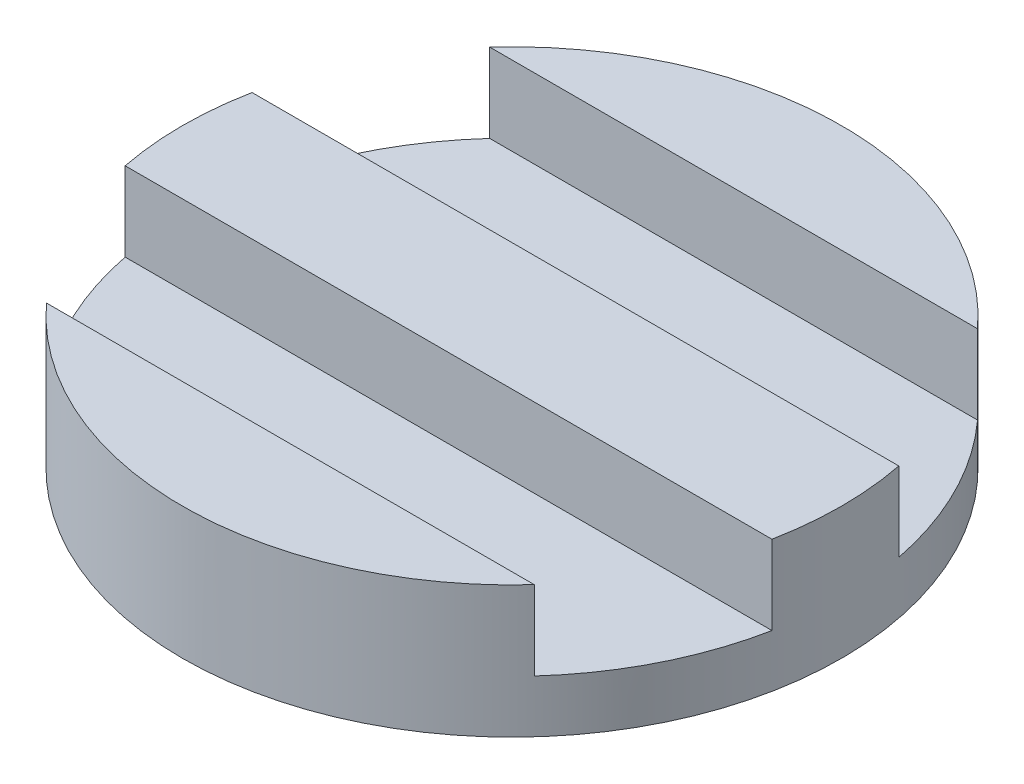
from build123d import *

# Parameters (mm, degrees)
SKETCH2_R           = 125
BOSS_EXTRUDE1_DEPTH = 50
CUT_EXTRUDE1_START  = -30
CUT_EXTRUDE1_DEPTH  = 30


with BuildPart() as part:
    # Sketch2 → Boss-Extrude1 (new body)
    with BuildSketch(Plane(origin=(0, 0, 0), x_dir=(1, 0, 0), z_dir=(0, 1, 0))):
        with Locations(Location((0, 0, 0), (0, 0, 270))):
            Circle(SKETCH2_R)
    extrude(amount=BOSS_EXTRUDE1_DEPTH)

    # Sketch3 → Cut-Extrude1 (cut)
    with BuildSketch(Plane(origin=(0, 50, 0), x_dir=(1, 0, 0), z_dir=(0, 1, 0)).offset(CUT_EXTRUDE1_START)):
        with BuildLine():
            Line((-122.662612071, 24.06), (122.662612071, 24.06))
            ThreePointArc((122.662612071, 24.06), (111.692828355, 56.122295874), (92.51441185, 84.06))
            Line((92.51441185, 84.06), (-92.51441185, 84.06))
            ThreePointArc((-92.51441185, 84.06), (-111.692828355, 56.122295874), (-122.662612071, 24.06))
        make_face()
        with BuildLine():
            Line((-122.662612071, -24.06), (122.662612071, -24.06))
            ThreePointArc((122.662612071, -24.06), (111.692828355, -56.122295874), (92.51441185, -84.06))
            Line((92.51441185, -84.06), (-92.51441185, -84.06))
            ThreePointArc((-92.51441185, -84.06), (-111.692828355, -56.122295874), (-122.662612071, -24.06))
        make_face()
    extrude(amount=CUT_EXTRUDE1_DEPTH, mode=Mode.SUBTRACT)


solid = part.part
